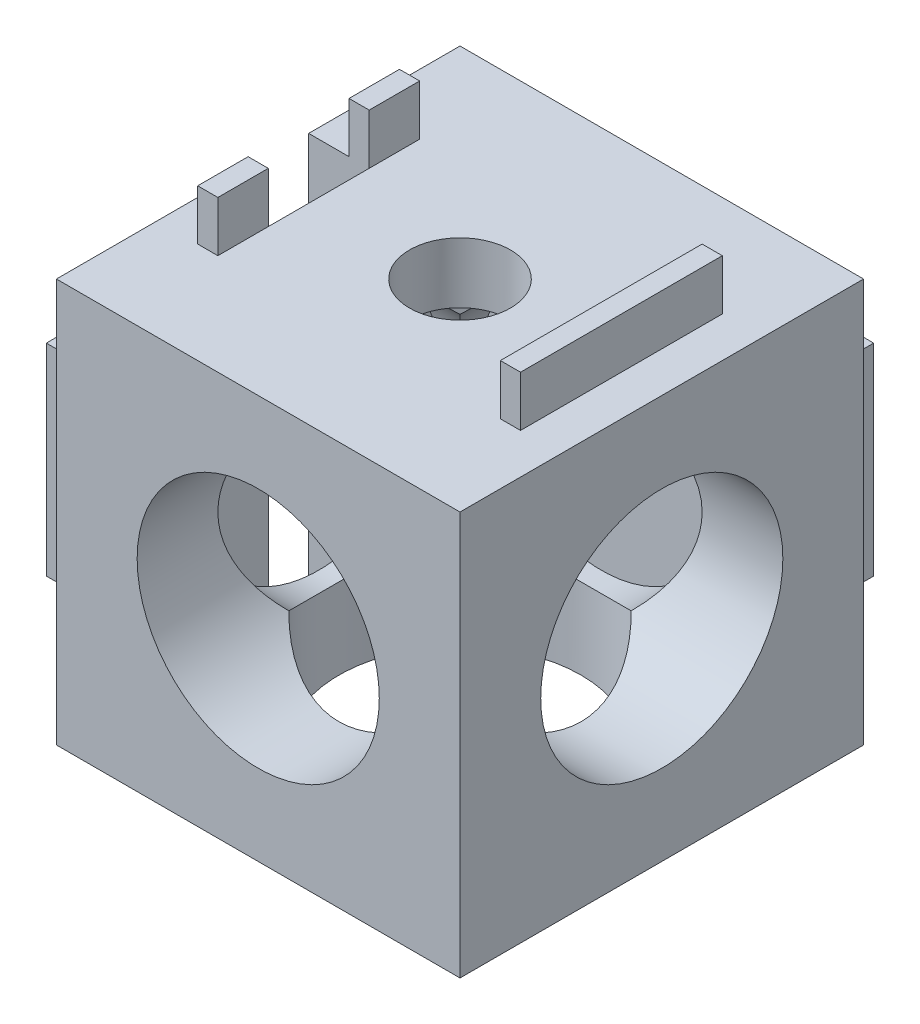
from build123d import *

# Parameters (mm, degrees)
BOSS_EXTRUDE1_DEPTH = 20
SKETCH2_W           = 1
SKETCH2_H           = 2.5
SKETCH2_H_2         = 10
BOSS_EXTRUDE2_DEPTH = 2.5
SKETCH2_3_R         = 2.5
CUT_EXTRUDE1_DEPTH  = 35.641016151
SKETCH3_W           = 1
SKETCH3_H           = 10
BOSS_EXTRUDE3_DEPTH = 2.5
SKETCH4_W           = 1
SKETCH4_H           = 10
SKETCH4_W_2         = 10
SKETCH4_H_2         = 1
BOSS_EXTRUDE4_DEPTH = 2.5
SKETCH4_3_R         = 2.5
CUT_EXTRUDE2_DEPTH  = 37.142080737
SKETCH5_R           = 6
CUT_EXTRUDE3_DEPTH  = 17
SKETCH6_R           = 6
CUT_EXTRUDE4_DEPTH  = 17
SKETCH7_R           = 6
CUT_EXTRUDE5_DEPTH  = 17


with BuildPart() as part:
    # Sketch1 → Boss-Extrude1 (new body)
    with BuildSketch(Plane(origin=(0, 0, 0), x_dir=(1, 0, 0), z_dir=(0, 1, 0))):
        Polygon((0, 7.5), (3, 7.5), (3, 12.5), (0, 12.5), (0, 20), (20, 20), (20, 0), (0, 0), align=None)
    extrude(amount=BOSS_EXTRUDE1_DEPTH)

    # Sketch2 → Boss-Extrude2 (add)
    with BuildSketch(Plane(origin=(0, 20, 0), x_dir=(1, 0, 0), z_dir=(0, 1, 0))):
        with Locations((2.5, 6.25)):
            Rectangle(SKETCH2_W, SKETCH2_H)
        with Locations((2.5, 13.75)):
            Rectangle(SKETCH2_W, SKETCH2_H)
        with Locations((17.5, 10)):
            Rectangle(SKETCH2_W, SKETCH2_H_2)
    extrude(amount=BOSS_EXTRUDE2_DEPTH)

    # Sketch2<3> → Cut-Extrude1 (cut, through all)
    with BuildSketch(Plane(origin=(0, 20, 0), x_dir=(1, 0, 0), z_dir=(0, 1, 0))):
        with Locations((10, 10)):
            Circle(SKETCH2_3_R)
    extrude(amount=-CUT_EXTRUDE1_DEPTH, mode=Mode.SUBTRACT)

    # Sketch3 → Boss-Extrude3 (add)
    with BuildSketch(Plane.ZY):
        with Locations((-2.5, 10)):
            Rectangle(SKETCH3_W, SKETCH3_H)
        with Locations((-17.5, 10)):
            Rectangle(SKETCH3_W, SKETCH3_H)
    extrude(amount=BOSS_EXTRUDE3_DEPTH)

    # Sketch4 → Boss-Extrude4 (add)
    with BuildSketch(Plane(origin=(0, 0, -20), x_dir=(-1, 0, 0), z_dir=(0, 0, -1))):
        with Locations((-17.5, 10)):
            Rectangle(SKETCH4_W, SKETCH4_H)
        with Locations((-2.5, 10)):
            Rectangle(SKETCH4_W, SKETCH4_H)
        with Locations((-10, 2.5)):
            Rectangle(SKETCH4_W_2, SKETCH4_H_2)
    extrude(amount=BOSS_EXTRUDE4_DEPTH)

    # Sketch4<3> → Cut-Extrude2 (cut, through all)
    with BuildSketch(Plane(origin=(0, 0, -20), x_dir=(-1, 0, 0), z_dir=(0, 0, -1))):
        with Locations((-10, 10)):
            Circle(SKETCH4_3_R)
    extrude(amount=-CUT_EXTRUDE2_DEPTH, mode=Mode.SUBTRACT)

    # Sketch5 → Cut-Extrude3 (cut)
    with BuildSketch(Plane(origin=(20, 0, 0), x_dir=(0, 0, -1), z_dir=(1, 0, 0))):
        with Locations((10, 10)):
            Circle(SKETCH5_R)
    extrude(amount=-CUT_EXTRUDE3_DEPTH, mode=Mode.SUBTRACT)

    # Sketch6 → Cut-Extrude4 (cut)
    with BuildSketch(Plane.XY):
        with Locations((10, 10)):
            Circle(SKETCH6_R)
    extrude(amount=-CUT_EXTRUDE4_DEPTH, mode=Mode.SUBTRACT)

    # Sketch7 → Cut-Extrude5 (cut)
    with BuildSketch(Plane.XZ):
        with Locations((10, -10)):
            Circle(SKETCH7_R)
    extrude(amount=-CUT_EXTRUDE5_DEPTH, mode=Mode.SUBTRACT)


solid = part.part
